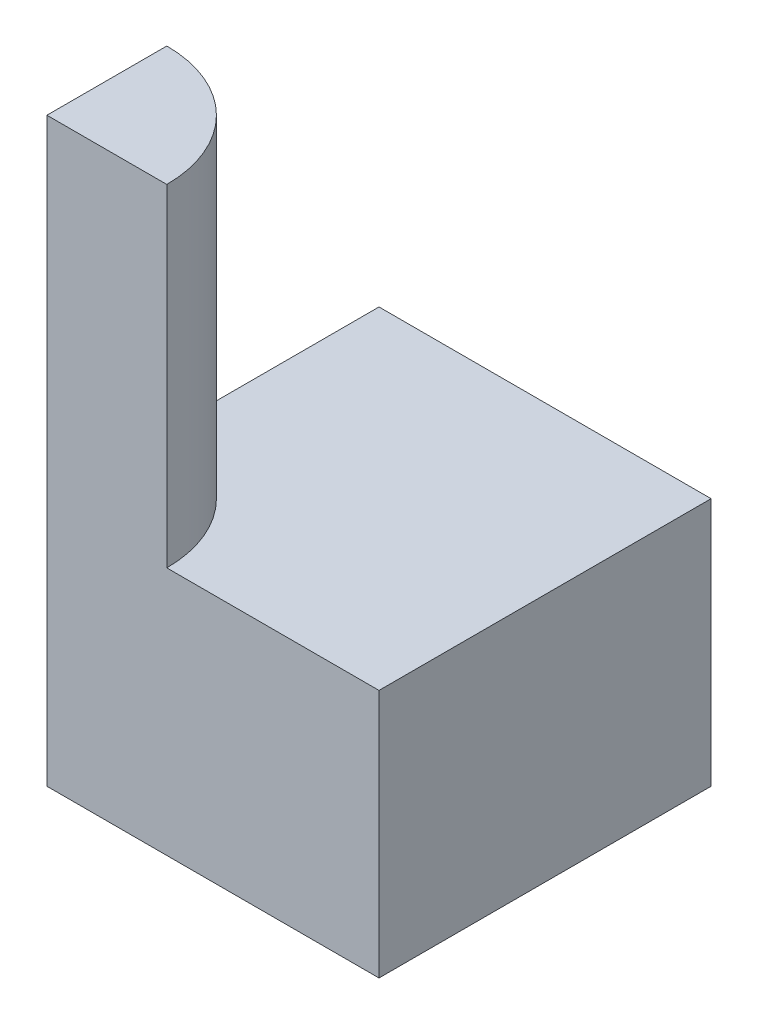
from build123d import *

# Parameters (mm, degrees)
SKETCH1_W           = 25.4
SKETCH1_H           = 25.4
BOSS_EXTRUDE1_DEPTH = 19.05
BOSS_EXTRUDE2_DEPTH = 25.4


with BuildPart() as part:
    # Sketch1 → Boss-Extrude1 (new body)
    with BuildSketch(Plane(origin=(0, 0, 0), x_dir=(1, 0, 0), z_dir=(0, 1, 0))):
        with Locations((12.7, 12.7)):
            Rectangle(SKETCH1_W, SKETCH1_H)
    extrude(amount=BOSS_EXTRUDE1_DEPTH)

    # Sketch3 → Boss-Extrude2 (add)
    with BuildSketch(Plane(origin=(0, 19.05, 0), x_dir=(1, 0, 0), z_dir=(0, 1, 0))):
        with BuildLine():
            Line((0, 0), (0, 9.1694))
            ThreePointArc((0, 9.1694), (6.483744919, 6.483744919), (9.1694, 0))
            Line((9.1694, 0), (0, 0))
        make_face()
    extrude(amount=BOSS_EXTRUDE2_DEPTH)


solid = part.part
